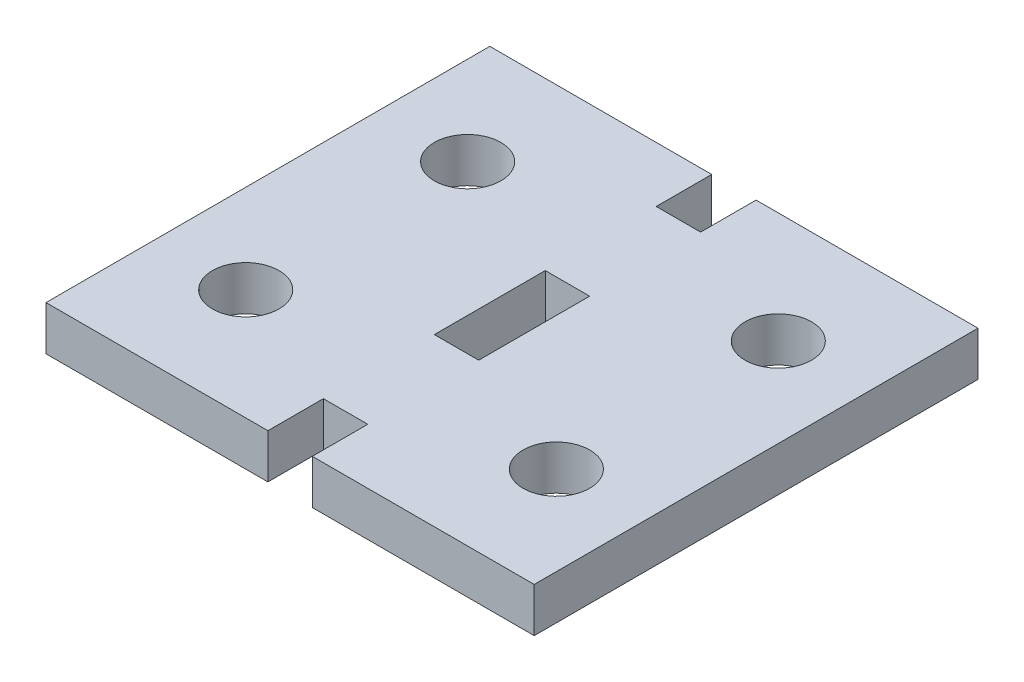
from build123d import *

# Parameters (mm, degrees)
SKETCH1_W           = 22
SKETCH1_H           = 20
BOSS_EXTRUDE1_DEPTH = 2
SKETCH2_R           = 1.5
SKETCH2_W           = 2
SKETCH2_H           = 2.5
SKETCH2_H_2         = 5
CUT_EXTRUDE1_DEPTH  = 2


with BuildPart() as part:
    # Sketch1 → Boss-Extrude1 (new body)
    with BuildSketch(Plane(origin=(0, 0, 0), x_dir=(1, 0, 0), z_dir=(0, 1, 0))):
        Rectangle(SKETCH1_W, SKETCH1_H)
    extrude(amount=BOSS_EXTRUDE1_DEPTH)

    # Sketch2 → Cut-Extrude1 (cut)
    with BuildSketch(Plane(origin=(0, 2, 0), x_dir=(1, 0, 0), z_dir=(0, 1, 0))):
        with Locations(Location((-7, 5, 0), (0, 0, 270))):
            Circle(SKETCH2_R)
        with Locations(Location((-7, -5, 0), (0, 0, 270))):
            Circle(SKETCH2_R)
        with Locations(Location((7, 5, 0), (0, 0, 270))):
            Circle(SKETCH2_R)
        with Locations(Location((7, -5, 0), (0, 0, 270))):
            Circle(SKETCH2_R)
        with Locations((0, 8.75)):
            Rectangle(SKETCH2_W, SKETCH2_H)
        Rectangle(SKETCH2_W, SKETCH2_H_2)
        with Locations((0, -8.75)):
            Rectangle(SKETCH2_W, SKETCH2_H)
    extrude(amount=-CUT_EXTRUDE1_DEPTH, mode=Mode.SUBTRACT)


solid = part.part
